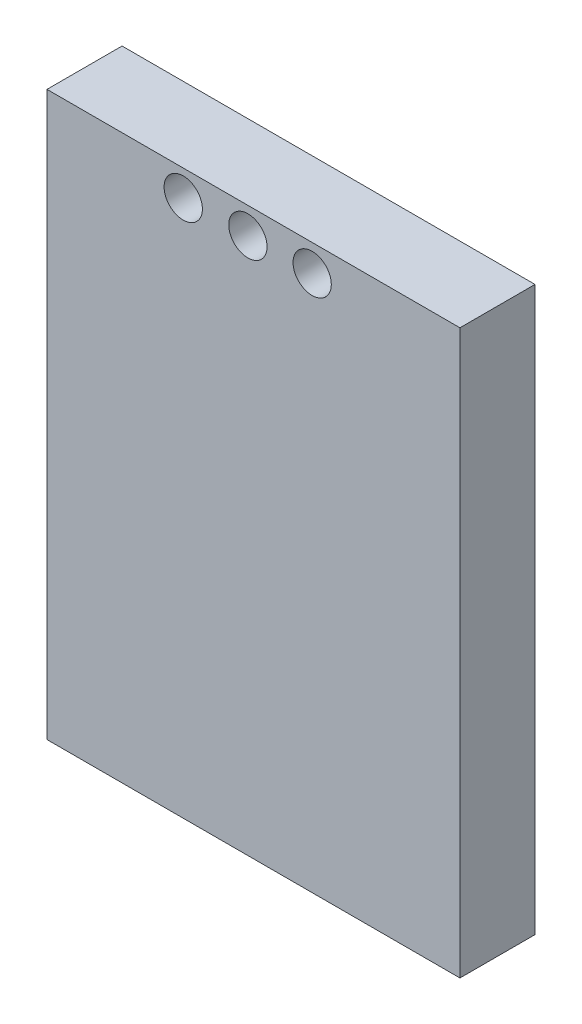
from build123d import *

# Parameters (mm, degrees)
SKETCH_1_W          = 11
SKETCH_1_H          = 15
EXTRUDE_1_DEPTH     = 2
SKETCH_2_R          = 0.510041948
CUT_EXTRUDE_1_DEPTH = 10.513148795


with BuildPart() as part:
    # 草图1 → 凸台-拉伸1 (new body)
    with BuildSketch(Plane.XY):
        Rectangle(SKETCH_1_W, SKETCH_1_H)
    extrude(amount=EXTRUDE_1_DEPTH)

    # 草图2 → 切除-拉伸1 (cut, through all)
    with BuildSketch(Plane.XY.offset(2)):
        with Locations((-1.870633726, 6.808344514)):
            Circle(SKETCH_2_R)
        with Locations((-0.147825369, 6.797010249)):
            Circle(SKETCH_2_R)
        with Locations((1.563648724, 6.785675983)):
            Circle(SKETCH_2_R)
    extrude(amount=-CUT_EXTRUDE_1_DEPTH, mode=Mode.SUBTRACT)


solid = part.part
